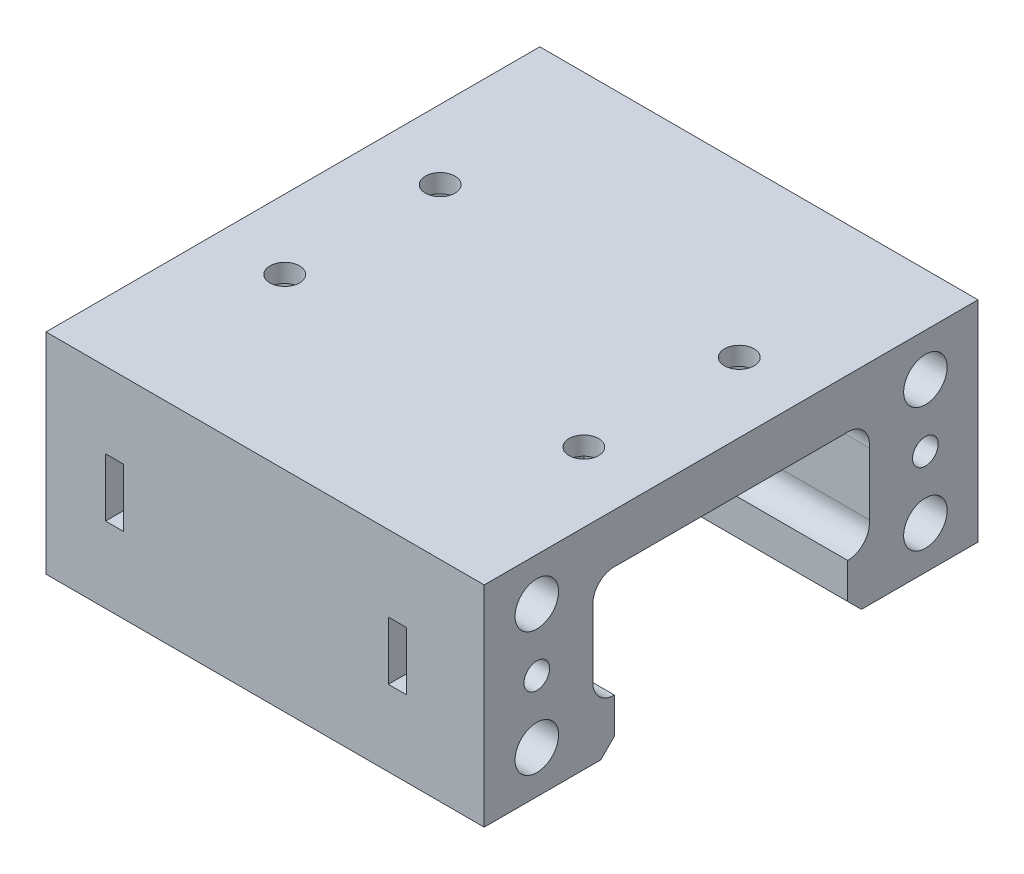
from build123d import *

# Parameters (mm, degrees)
SKETCH2_R           = 2.778125
BOSS_EXTRUDE2_DEPTH = 56.3835756
SKETCH3_R           = 1.651
CUT_EXTRUDE1_DEPTH  = 22.1668
SKETCH4_W           = 10.767766953
SKETCH4_H           = 2.34
CUT_EXTRUDE2_DEPTH  = 3.75
SKETCH5_R           = 2.8
CUT_EXTRUDE3_DEPTH  = 80.995318373
SKETCH6_R           = 1.905
CUT_EXTRUDE4_DEPTH  = 77.107177875
CUT_EXTRUDE5_DEPTH  = 4


with BuildPart() as part:
    # Sketch2 → Boss-Extrude2 (new body)
    with BuildSketch(Plane(origin=(0, 0, 0), x_dir=(0, 0, -1), z_dir=(1, 0, 0))):
        with BuildLine():
            Line((0, 25.778125), (30, 25.778125))
            ThreePointArc((30, 25.778125), (31.964431026, 24.964431026), (32.778125, 23))
            Line((32.778125, 23), (32.778125, 14.278125))
            ThreePointArc((32.778125, 14.278125), (31.964431026, 12.313693974), (30, 11.5))
            Line((30, 11.5), (30, 6.906829453))
            Line((30, 6.906829453), (31.767766953, 5.1390625))
            Line((31.767766953, 5.1390625), (46.767766953, 5.1390625))
            Line((46.767766953, 5.1390625), (46.767766953, 32.1390625))
            Line((46.767766953, 32.1390625), (-16.767766953, 32.1390625))
            Line((-16.767766953, 32.1390625), (-16.767766953, 5.1390625))
            Line((-16.767766953, 5.1390625), (-1.767766953, 5.1390625))
            Line((-1.767766953, 5.1390625), (0, 6.906829453))
            Line((0, 6.906829453), (0, 11.5))
            ThreePointArc((0, 11.5), (-1.964431026, 12.313693974), (-2.778125, 14.278125))
            Line((-2.778125, 14.278125), (-2.778125, 23))
            ThreePointArc((-2.778125, 23), (-1.964431026, 24.964431026), (0, 25.778125))
        make_face()
        with Locations((-10, 26.6390625)):
            Circle(SKETCH2_R, mode=Mode.SUBTRACT)
        with Locations((-10, 10.6390625)):
            Circle(SKETCH2_R, mode=Mode.SUBTRACT)
        with Locations((40, 10.6390625)):
            Circle(SKETCH2_R, mode=Mode.SUBTRACT)
        with Locations((40, 26.6390625)):
            Circle(SKETCH2_R, mode=Mode.SUBTRACT)
    extrude(amount=BOSS_EXTRUDE2_DEPTH)

    # Sketch3 → Cut-Extrude1 (cut)
    with BuildSketch(Plane(origin=(56.3835756, 0, 0), x_dir=(0, 0, -1), z_dir=(1, 0, 0))):
        with Locations((-10, 18.6390625)):
            Circle(SKETCH3_R)
        with Locations((40, 18.6390625)):
            Circle(SKETCH3_R)
    cut_extrude1 = extrude(amount=-CUT_EXTRUDE1_DEPTH, mode=Mode.SUBTRACT)

    # Sketch4 → Cut-Extrude2 (cut, symmetric)
    with BuildSketch(Plane(origin=(0, 18.6390625, 0), x_dir=(0, 0, -1), z_dir=(0, -1, 0))):
        with Locations((-11.383883477, 45.2135756)):
            Rectangle(SKETCH4_W, SKETCH4_H)
        with Locations((41.383883477, 45.2135756)):
            Rectangle(SKETCH4_W, SKETCH4_H)
        with Locations((-11.383883477, 8.83)):
            Rectangle(SKETCH4_W, SKETCH4_H)
        with Locations((41.383883477, 8.83)):
            Rectangle(SKETCH4_W, SKETCH4_H)
    extrude(amount=CUT_EXTRUDE2_DEPTH, both=True, mode=Mode.SUBTRACT)

    # Sketch5 → Cut-Extrude3 (cut, through all)
    with BuildSketch(Plane(origin=(56.3835756, 0, 0), x_dir=(0, 0, -1), z_dir=(1, 0, 0))):
        with Locations((-10, 26.6390625)):
            Circle(SKETCH5_R)
        with Locations((0, 23)):
            Circle(SKETCH5_R)
        with Locations((-10, 10.6390625)):
            Circle(SKETCH5_R)
        with Locations((40, 26.6390625)):
            Circle(SKETCH5_R)
        with Locations((40, 10.6390625)):
            Circle(SKETCH5_R)
        with Locations((30, 23)):
            Circle(SKETCH5_R)
        with Locations((0, 14.278125)):
            Circle(SKETCH5_R)
        with Locations((30, 14.278125)):
            Circle(SKETCH5_R)
    extrude(amount=-CUT_EXTRUDE3_DEPTH, mode=Mode.SUBTRACT)

    # Mirror1: Cut-Extrude1 across plane
    add(cut_extrude1.mirror(Plane.ZY.offset(-28.1917878)), mode=Mode.SUBTRACT)

    # Sketch6 → Cut-Extrude4 (cut, through all)
    with BuildSketch(Plane.XZ.offset(-25.778125)):
        with Locations((8.949145412, -5)):
            Circle(SKETCH6_R)
        with Locations((47.434430188, -5)):
            Circle(SKETCH6_R)
        with Locations((47.434430188, -25)):
            Circle(SKETCH6_R)
        with Locations((8.949145412, -25)):
            Circle(SKETCH6_R)
    extrude(amount=-CUT_EXTRUDE4_DEPTH, mode=Mode.SUBTRACT)

    # Sketch7 → Cut-Extrude5 (cut)
    with BuildSketch(Plane(origin=(0, 25.778125, 0), x_dir=(-1, 0, 0), z_dir=(0, -1, 0))):
        Polygon((-12.166931132, 27.281957343), (-12.534271302, 23.354294494), (-9.316485582, 21.072337151), (-5.731359693, 22.718042657), (-5.364019523, 26.645705506), (-8.581805243, 28.927662849), align=None)
        Polygon((-12.465792586, 6.787363117), (-12.255370864, 2.84817577), (-8.73872369, 1.060812653), (-5.432498239, 3.212636883), (-5.642919961, 7.15182423), (-9.159567134, 8.939187347), align=None)
        Polygon((-44.671186116, 7.815307524), (-48.490935987, 8.800693325), (-51.254180059, 5.985385801), (-50.197674259, 2.184692476), (-46.377924389, 1.199306675), (-43.614680317, 4.014614199), align=None)
        Polygon((-43.896441738, 26.74473837), (-47.176423714, 28.936357061), (-50.714412164, 27.191618691), (-50.972418638, 23.25526163), (-47.692436661, 21.063642939), (-44.154448211, 22.808381309), align=None)
    extrude(amount=-CUT_EXTRUDE5_DEPTH, mode=Mode.SUBTRACT)


solid = part.part
